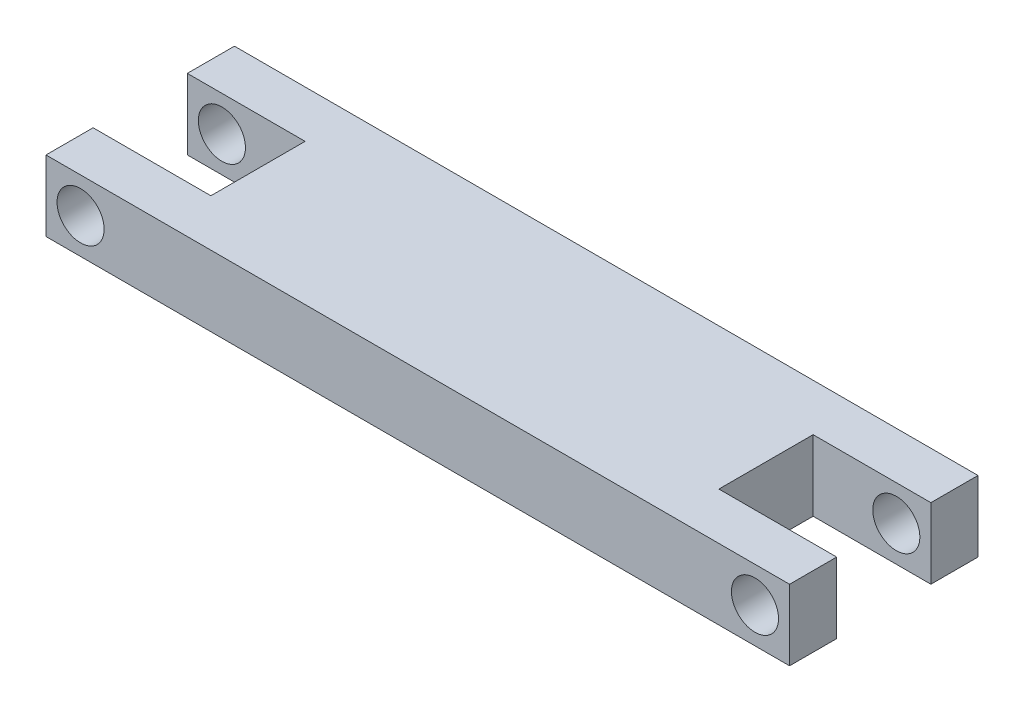
from build123d import *

# Parameters (mm, degrees)
SKETCH_1_W          = 200
SKETCH_1_H          = 15
SKETCH_1_R          = 5
EXTRUDE_2_DEPTH     = 40
SKETCH_2_W          = 50
SKETCH_2_H          = 20
CUT_EXTRUDE_2_DEPTH = 40
SKETCH_3_W          = 242.163651579
SKETCH_3_H          = 102.30151502
CUT_EXTRUDE_3_DEPTH = 40


with BuildPart() as part:
    # 草图1 → 凸台-拉伸2 (new body)
    with BuildSketch(Plane.XY):
        with Locations((26.359649123, 8.070175439)):
            Rectangle(SKETCH_1_W, SKETCH_1_H)
        with Locations((-66.300631579, 8.070175439)):
            Circle(SKETCH_1_R, mode=Mode.SUBTRACT)
        with Locations((118.699368421, 8.070175439)):
            Circle(SKETCH_1_R, mode=Mode.SUBTRACT)
    extrude(amount=EXTRUDE_2_DEPTH)

    # 草图2 → 切除-拉伸2 (cut)
    with BuildSketch(Plane(origin=(0, 15.570175439, 0), x_dir=(1, 0, 0), z_dir=(0, 1, 0))):
        with Locations((-73.640350877, -20)):
            Rectangle(SKETCH_2_W, SKETCH_2_H)
        with Locations((126.359649123, -20)):
            Rectangle(SKETCH_2_W, SKETCH_2_H)
    extrude(amount=-CUT_EXTRUDE_2_DEPTH, mode=Mode.SUBTRACT)

    # 草图3 → 切除-拉伸3 (cut)
    with BuildSketch(Plane(origin=(0, 15.570175439, 0), x_dir=(1, 0, 0), z_dir=(0, 1, 0))):
        with Locations((126.359649123, 0)):
            Rectangle(SKETCH_3_W, SKETCH_3_H)
    extrude(amount=-CUT_EXTRUDE_3_DEPTH, mode=Mode.SUBTRACT)

    # 镜向2: part across plane


with BuildPart() as part_1:
    add(part.part)
    add(part.part.mirror(Plane(origin=(5.277823333, -24.429824561, -51.15075751), x_dir=(0, 0, 1), z_dir=(-1, 0, 0))))


solid = part_1.part
